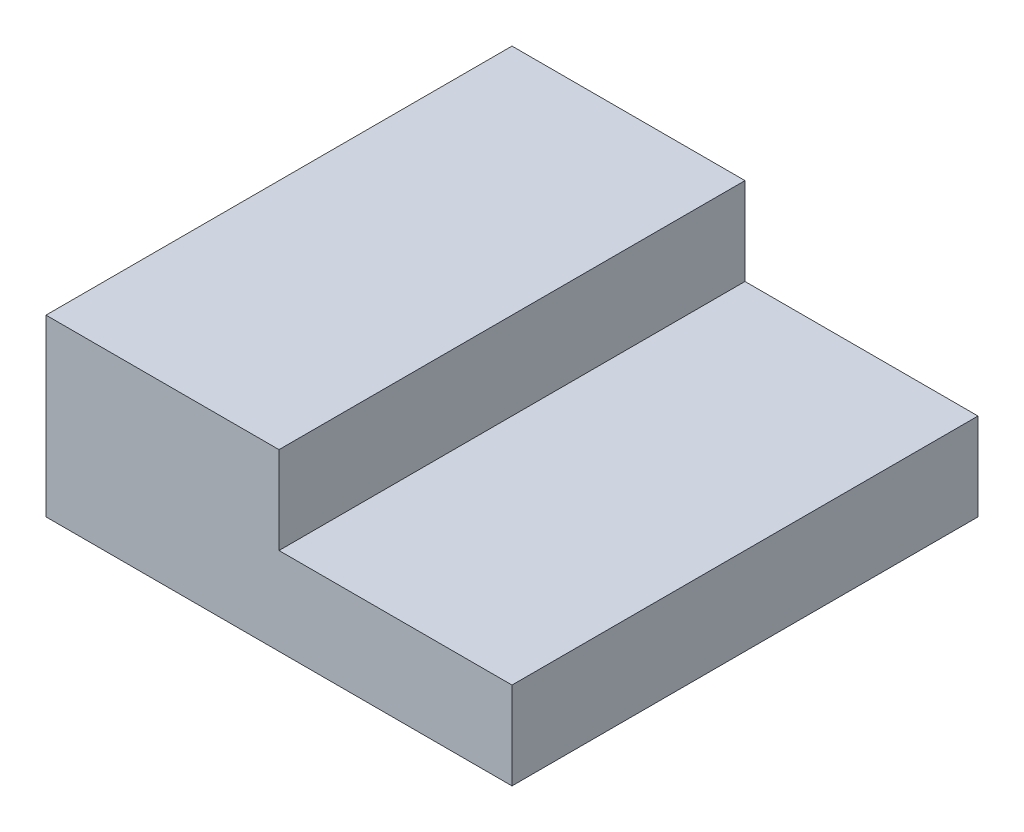
from build123d import *

# Parameters (mm, degrees)
BOSS_EXTRUDE1_DEPTH = 609.6


with BuildPart() as part:
    # Sketch1 → Boss-Extrude1 (new body)
    with BuildSketch(Plane.XY):
        Polygon((0, 0), (609.6, 0), (609.6, 114.3), (304.8, 114.3), (304.8, 228.6), (0, 228.6), align=None)
    extrude(amount=-BOSS_EXTRUDE1_DEPTH)


solid = part.part
